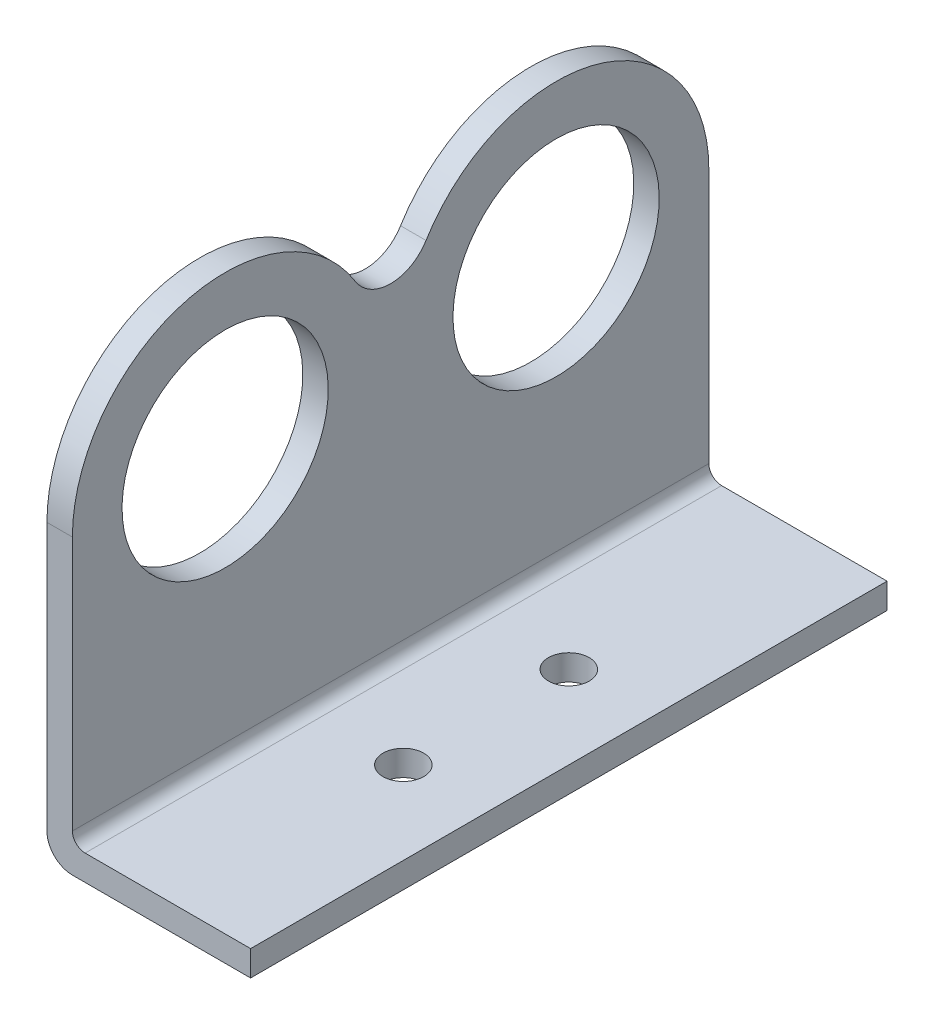
from build123d import *

# Parameters (mm, degrees)
BOSS_EXTRUDE1_DEPTH = 50
SKETCH2_R           = 1.6
CUT_EXTRUDE1_DEPTH  = 50
SKETCH3_R           = 8.1
CUT_EXTRUDE2_DEPTH  = 50


with BuildPart() as part:
    # Sketch1 → Boss-Extrude1 (new body)
    with BuildSketch(Plane.XY):
        with BuildLine():
            Line((0, 35), (0, 2))
            ThreePointArc((0, 2), (0.585786438, 0.585786438), (2, 0))
            Line((2, 0), (16, 0))
            Line((16, 0), (16, 2))
            Line((16, 2), (3, 2))
            ThreePointArc((3, 2), (2.292893219, 2.292893219), (2, 3))
            Line((2, 3), (2, 35))
            Line((2, 35), (0, 35))
        make_face()
    extrude(amount=BOSS_EXTRUDE1_DEPTH)

    # Sketch2 → Cut-Extrude1 (cut)
    with BuildSketch(Plane(origin=(0, 2, 0), x_dir=(1, 0, 0), z_dir=(0, 1, 0))):
        with Locations(Location((9.5, -18.5, 0), (0, 0, 270))):
            Circle(SKETCH2_R)
        with Locations(Location((9.5, -31.5, 0), (0, 0, 270))):
            Circle(SKETCH2_R)
    extrude(amount=-CUT_EXTRUDE1_DEPTH, mode=Mode.SUBTRACT)

    # Sketch3 → Cut-Extrude2 (cut)
    with BuildSketch(Plane(origin=(2, 0, 0), x_dir=(0, 0, -1), z_dir=(1, 0, 0))):
        with Locations(Location((-12, 23, 0), (0, 0, 90))):
            Circle(SKETCH3_R)
        with Locations(Location((-38, 23, 0), (0, 0, 90))):
            Circle(SKETCH3_R)
        with BuildLine():
            ThreePointArc((-50, 23), (-46.485281374, 31.485281374), (-38, 35))
            Line((-38, 35), (-50, 35))
            Line((-50, 35), (-50, 23))
        make_face()
        with BuildLine():
            ThreePointArc((-22.2198998, 29.289169108), (-17.8536301, 33.475448184), (-12, 35))
            Line((-12, 35), (-38, 35))
            ThreePointArc((-38, 35), (-32.1463699, 33.475448184), (-27.7801002, 29.289169108))
            ThreePointArc((-27.7801002, 29.289169108), (-25, 27.735662478), (-22.2198998, 29.289169108))
        make_face()
        with BuildLine():
            Line((0, 35), (-12, 35))
            ThreePointArc((-12, 35), (-3.514718626, 31.485281374), (0, 23))
            Line((0, 23), (0, 35))
        make_face()
    extrude(amount=-CUT_EXTRUDE2_DEPTH, mode=Mode.SUBTRACT)


solid = part.part
